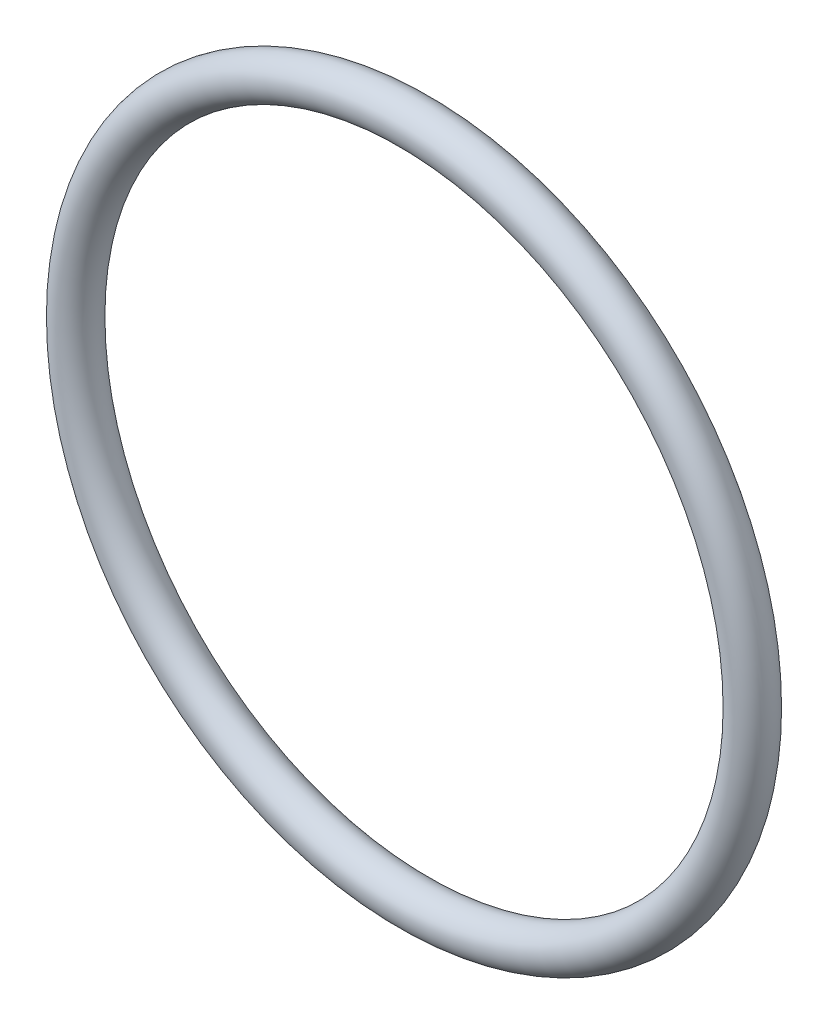
from build123d import *

# Parameters (mm, degrees)
SKETCH1_R = 2.667


with BuildPart() as part:
    # Sketch1 → Revolve1 (revolve)
    with BuildSketch(Plane(origin=(0, 0, 0), x_dir=(0, -1, 0), z_dir=(1, 0, 0)), mode=Mode.PRIVATE) as revolve1_sk:
        with Locations((43.6245, 0)):
            Circle(SKETCH1_R)
    revolve(revolve1_sk.sketch.rotate(Axis((0, 0, 2.667), (0, 0, -1)), 270), axis=Axis((0, 0, 2.667), (0, 0, -1)))


solid = part.part
